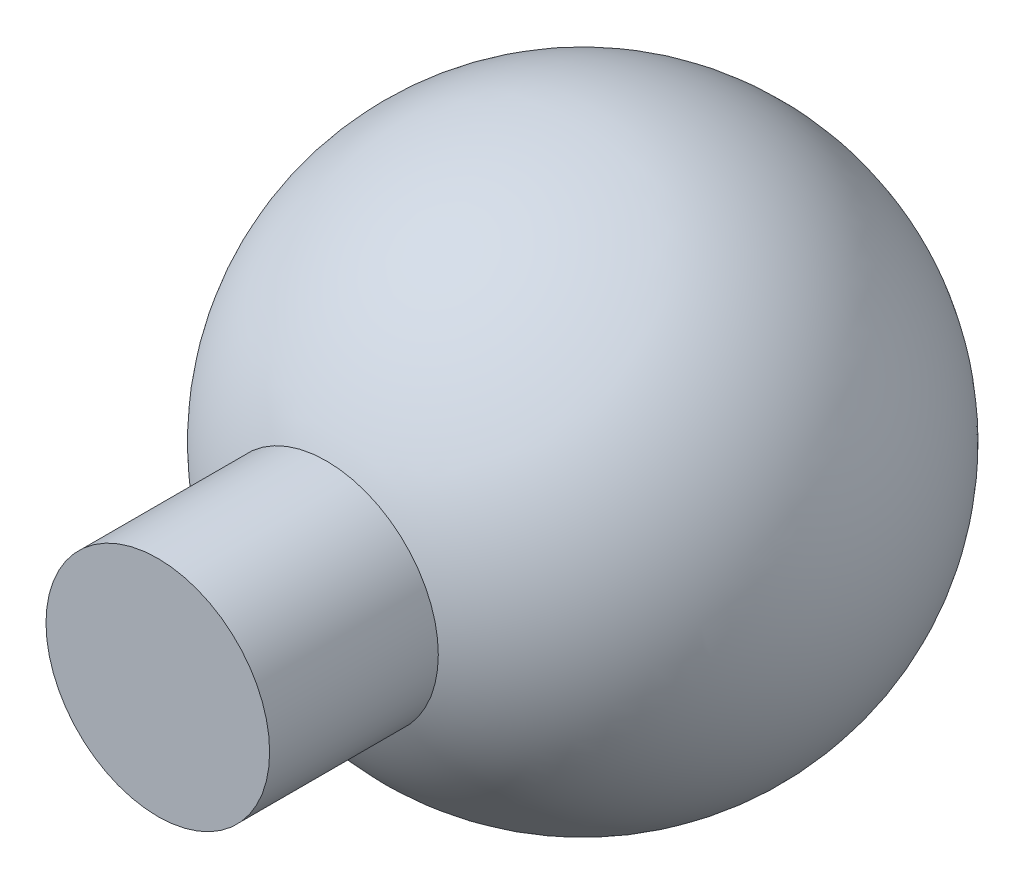
from build123d import *


with BuildPart() as part:
    # Sketch1 → Revolve1 (revolve)
    with BuildSketch(Plane(origin=(0, 0, 0), x_dir=(1, 0, 0), z_dir=(0, 1, 0))):
        with BuildLine():
            Line((0, 13), (0, 63))
            ThreePointArc((0, 63), (25, 38), (0, 13))
        make_face()
        with BuildLine():
            Line((10, 0), (10, 13))
            Line((10, 13), (10, 15.087121525))
            ThreePointArc((10, 15.087121525), (5.107741092, 13.527342177), (0, 13))
            Line((0, 13), (0, 0))
            Line((0, 0), (10, 0))
        make_face()
    revolve(axis=Axis((0, 0, 0), (0, 0, -1)))


solid = part.part
